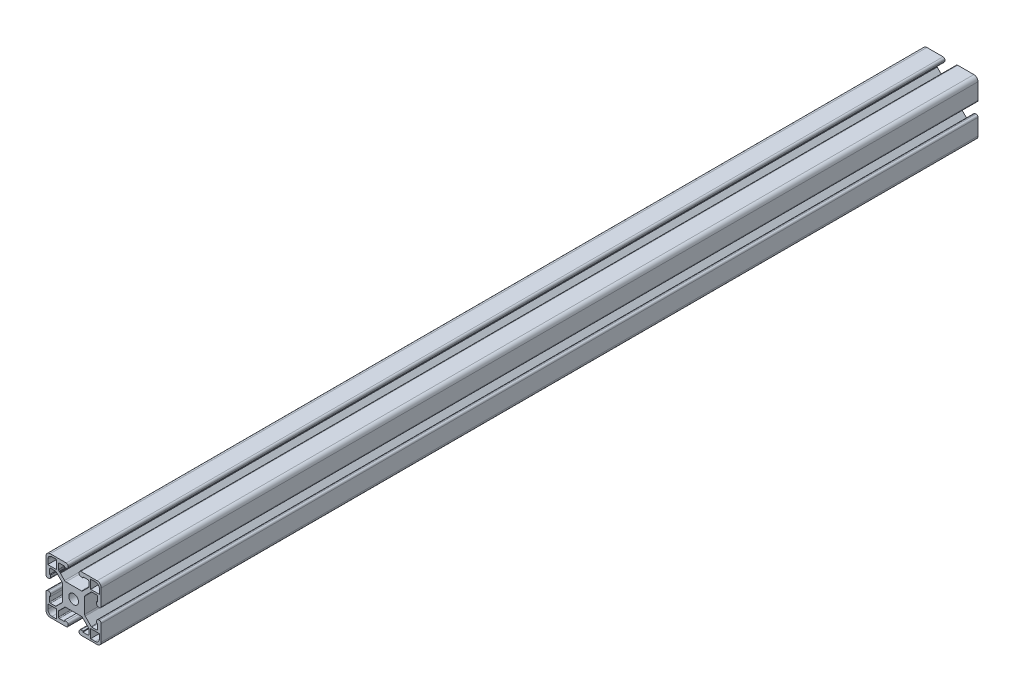
from build123d import *

# Parameters (mm, degrees)
BOSS_EXTRUDE1_DEPTH     = 317.5
CUT_EXTRUDE1_DEPTH      = 319.757352856
CUT_EXTRUDE1_DEPTH_BACK = 319.757352856


with BuildPart() as part:
    # Sketch4 → Boss-Extrude1 (new, symmetric)
    with BuildSketch(Plane.XY):
        with BuildLine():
            Line((20, -17), (20, -5.32))
            ThreePointArc((20, -5.32), (19.613380951, -4.386619049), (18.68, -4))
            Line((18.68, -4), (18.02, -4))
            ThreePointArc((18.02, -4), (17.086619049, -4.386619049), (16.7, -5.32))
            Line((16.7, -5.32), (16.7, -6.75))
            Line((16.7, -6.75), (17.36, -6.75))
            Line((17.36, -6.75), (17.36, -10.4))
            ThreePointArc((17.36, -10.4), (17.184264069, -10.824264069), (16.76, -11))
            Line((16.76, -11), (13.11529004, -11))
            ThreePointArc((13.11529004, -11), (12.88567998, -10.95432772), (12.691025971, -10.824264069))
            Line((12.691025971, -10.824264069), (8.386619049, -6.519857147))
            ThreePointArc((8.386619049, -6.519857147), (8.100479017, -6.091618326), (8, -5.586476195))
            Line((8, -5.586476195), (8, 0))
            Line((8, 0), (3.5, 0))
            ThreePointArc((3.5, 0), (2.474873734, -2.474873734), (0, -3.5))
            Line((0, -3.5), (0, -8))
            Line((0, -8), (5.586476195, -8))
            ThreePointArc((5.586476195, -8), (6.091618326, -8.100479017), (6.519857147, -8.386619049))
            Line((6.519857147, -8.386619049), (10.824264069, -12.691025971))
            ThreePointArc((10.824264069, -12.691025971), (10.95432772, -12.88567998), (11, -13.11529004))
            Line((11, -13.11529004), (11, -16.76))
            ThreePointArc((11, -16.76), (10.824264069, -17.184264069), (10.4, -17.36))
            Line((10.4, -17.36), (6.75, -17.36))
            Line((6.75, -17.36), (6.75, -16.7))
            Line((6.75, -16.7), (5.32, -16.7))
            ThreePointArc((5.32, -16.7), (4.386619049, -17.086619049), (4, -18.02))
            Line((4, -18.02), (4, -18.68))
            ThreePointArc((4, -18.68), (4.386619049, -19.613380951), (5.32, -20))
            Line((5.32, -20), (17, -20))
            ThreePointArc((17, -20), (19.121320344, -19.121320344), (20, -17))
        make_face()
        with BuildLine():
            Line((15.68, -18.68), (12.32, -18.68))
            Line((12.32, -18.68), (12.32, -12.32))
            Line((12.32, -12.32), (18.68, -12.32))
            Line((18.68, -12.32), (18.68, -15.68))
            ThreePointArc((18.68, -15.68), (17.801320344, -17.801320344), (15.68, -18.68))
        make_face(mode=Mode.SUBTRACT)
    extrude(amount=BOSS_EXTRUDE1_DEPTH, both=True)

    # Mirror1: part across plane


with BuildPart() as part_1:
    add(part.part)
    add(part.part.mirror(Plane(origin=(0, 0, 0), x_dir=(0, 0, 1), z_dir=(1, 0, 0))))

    # Mirror2: part across plane


with BuildPart() as part_2:
    add(part_1.part)
    add(part_1.part.mirror(Plane.ZX))

    # Sketch5 → Cut-Extrude1 (cut, two sides: drawn at the far end of the back side and taken through both)
    with BuildSketch(Plane.XY.offset(-CUT_EXTRUDE1_DEPTH_BACK)):
        Polygon((-10.453238098, 12.32), (-10.453238098, 11.99), (-10.123238098, 11.99), (-9.88989286, 11.756654762), (-9.88989286, 11.426654762), (-9.55989286, 11.426654762), (-9.55989286, 12.32), align=None)
    extrude(amount=CUT_EXTRUDE1_DEPTH + CUT_EXTRUDE1_DEPTH_BACK, mode=Mode.SUBTRACT)


solid = part_2.part
